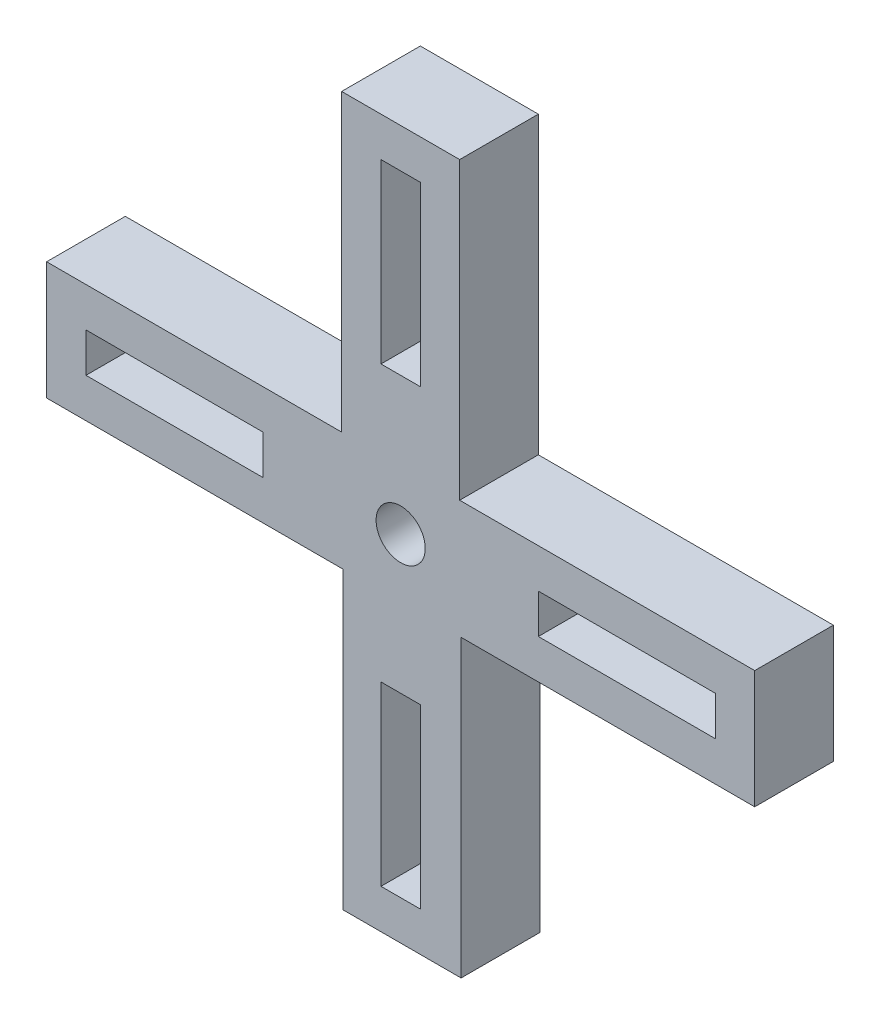
from build123d import *

# Parameters (mm, degrees)
ESQUISSE1_W             = 2
ESQUISSE1_H             = 9
ESQUISSE1_W_2           = 9
ESQUISSE1_H_2           = 2
BOSS_EXTRU_4_DEPTH      = 4
ESQUISSE2_R             = 1.25
ENL_V_MAT_EXTRU_1_DEPTH = 4


with BuildPart() as part:
    # Esquisse1 → Boss.-Extru.4 (new body)
    with BuildSketch(Plane.XY):
        Polygon((0, 0), (-6, 0), (-6, -15), (-21, -15), (-21, -21), (-5.927854654, -21), (-5.927854654, -36), (0.072145346, -36), (0.072145346, -21), (15, -21), (15, -15), (0, -15), align=None)
        with Locations((-3, -6.5)):
            Rectangle(ESQUISSE1_W, ESQUISSE1_H, mode=Mode.SUBTRACT)
        with Locations((-14.5, -18)):
            Rectangle(ESQUISSE1_W_2, ESQUISSE1_H_2, mode=Mode.SUBTRACT)
        with Locations((-3, -29.5)):
            Rectangle(ESQUISSE1_W, ESQUISSE1_H, mode=Mode.SUBTRACT)
        with Locations((8.5, -18)):
            Rectangle(ESQUISSE1_W_2, ESQUISSE1_H_2, mode=Mode.SUBTRACT)
    extrude(amount=BOSS_EXTRU_4_DEPTH)

    # Esquisse2 → Enlèv. mat.-Extru.1 (cut)
    with BuildSketch(Plane.XY.offset(4)):
        with Locations((-3, -18)):
            Circle(ESQUISSE2_R)
    extrude(amount=-ENL_V_MAT_EXTRU_1_DEPTH, mode=Mode.SUBTRACT)


solid = part.part
